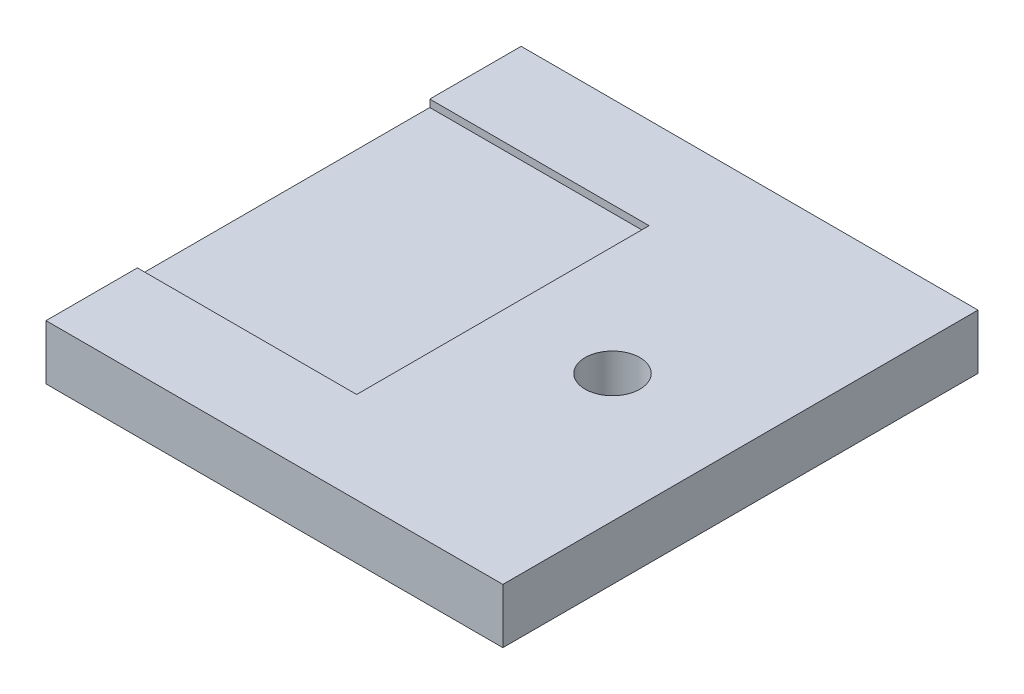
from build123d import *

# Parameters (mm, degrees)
SKETCH2_W           = 25
SKETCH2_H           = 26
SKETCH2_R           = 1.5
BOSS_EXTRUDE1_DEPTH = 3
SKETCH4_W           = 12
SKETCH4_H           = 16
CUT_EXTRUDE1_DEPTH  = 0.4


with BuildPart() as part:
    # Sketch2 → Boss-Extrude1 (new body)
    with BuildSketch(Plane(origin=(0, 0, 0), x_dir=(1, 0, 0), z_dir=(0, 1, 0))):
        with Locations((12.5, 13)):
            Rectangle(SKETCH2_W, SKETCH2_H)
        with Locations(Location((18, 13, 0), (0, 0, 270))):
            Circle(SKETCH2_R, mode=Mode.SUBTRACT)
    extrude(amount=BOSS_EXTRUDE1_DEPTH)

    # Sketch4 → Cut-Extrude1 (cut)
    with BuildSketch(Plane(origin=(0, 3, 0), x_dir=(1, 0, 0), z_dir=(0, 1, 0))):
        with Locations((6, 13)):
            Rectangle(SKETCH4_W, SKETCH4_H)
    extrude(amount=-CUT_EXTRUDE1_DEPTH, mode=Mode.SUBTRACT)


solid = part.part
